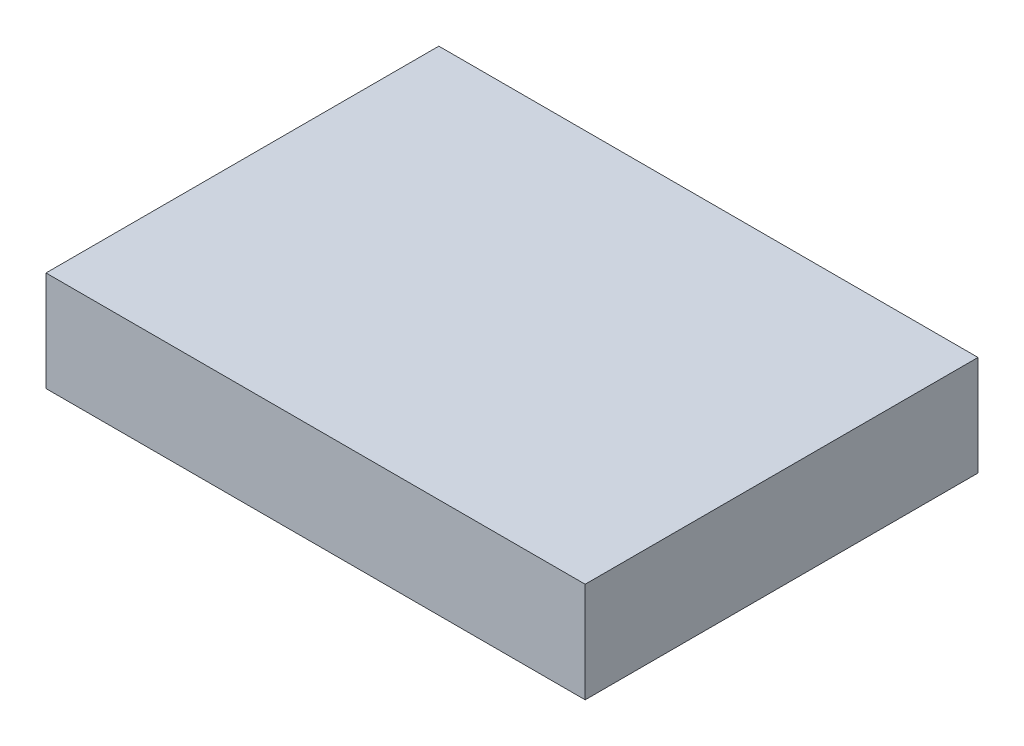
from build123d import *

# Parameters (mm, degrees)
SKETCH1_W           = 35
SKETCH1_H           = 25.5
BOSS_EXTRUDE1_DEPTH = 6.5


with BuildPart() as part:
    # Sketch1 → Boss-Extrude1 (new body)
    with BuildSketch(Plane(origin=(0, 0, 0), x_dir=(1, 0, 0), z_dir=(0, 1, 0))):
        with Locations((17.5, 12.75)):
            Rectangle(SKETCH1_W, SKETCH1_H)
    extrude(amount=BOSS_EXTRUDE1_DEPTH)


solid = part.part
